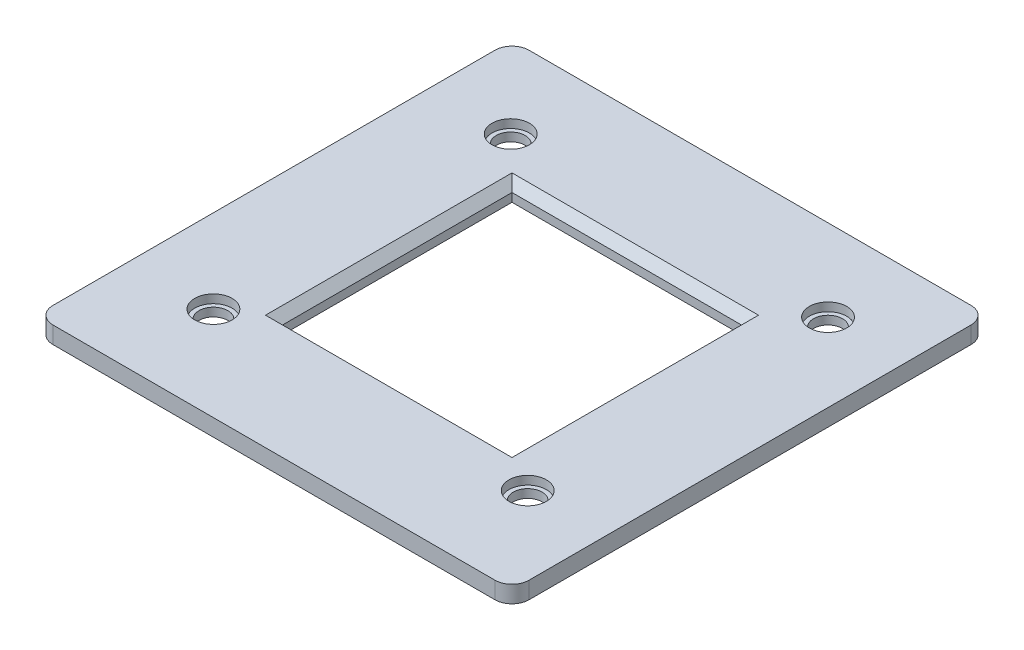
from build123d import *

# Parameters (mm, degrees)
SKETCH1_W                                            = 56
SKETCH1_H                                            = 56
SKETCH1_W_2                                          = 27
SKETCH1_H_2                                          = 27
BOSS_EXTRUDE1_DEPTH                                  = 2
CHAMFER1_SIZE                                        = 1
CBORE_FOR_M3_CROSS_RECESS_PAN_HEAD_SCREW_D           = 3.4
CBORE_FOR_M3_CROSS_RECESS_PAN_HEAD_SCREW_DEPTH       = 5
CBORE_FOR_M3_CROSS_RECESS_PAN_HEAD_SCREW_CBORE_D     = 4.4
CBORE_FOR_M3_CROSS_RECESS_PAN_HEAD_SCREW_CBORE_DEPTH = 1
CBORE_FOR_M3_CROSS_RECESS_PAN_HEAD_SCREW_TIP         = 1.021463052
FILLET1_R                                            = 2


with BuildPart() as part:
    # Sketch1 → Boss-Extrude1 (new body)
    with BuildSketch(Plane(origin=(0, 0, 0), x_dir=(1, 0, 0), z_dir=(0, 1, 0))):
        with Locations((28, 28)):
            Rectangle(SKETCH1_W, SKETCH1_H)
        with Locations((28, 28)):
            Rectangle(SKETCH1_W_2, SKETCH1_H_2, mode=Mode.SUBTRACT)
    extrude(amount=BOSS_EXTRUDE1_DEPTH)

    # Chamfer1
    chamfer1_edges = [part.edges().sort_by_distance(p)[0] for p in [
        (14.5, 2, -28),
        (28, 2, -14.5),
        (41.5, 2, -28),
        (28, 2, -41.5),
    ]]
    chamfer(chamfer1_edges, length=CHAMFER1_SIZE)

    # CBORE for M3 Cross Recess Pan Head Screw1
    with Locations(Plane(origin=(0, 2, 0), x_dir=(1, 0, 0), z_dir=(0, 1, 0))):
        with Locations((9.461899873, 46.384256973), (46.794505385, 46.384256973), (46.794505385, 11.05161247), (9.820867233, 11.05161247)):
            CounterBoreHole(CBORE_FOR_M3_CROSS_RECESS_PAN_HEAD_SCREW_D / 2, CBORE_FOR_M3_CROSS_RECESS_PAN_HEAD_SCREW_CBORE_D / 2, CBORE_FOR_M3_CROSS_RECESS_PAN_HEAD_SCREW_CBORE_DEPTH, depth=CBORE_FOR_M3_CROSS_RECESS_PAN_HEAD_SCREW_DEPTH)
            with Locations((0, 0, -(CBORE_FOR_M3_CROSS_RECESS_PAN_HEAD_SCREW_DEPTH + CBORE_FOR_M3_CROSS_RECESS_PAN_HEAD_SCREW_TIP / 2))):  # 118° drill point
                Cone(0, CBORE_FOR_M3_CROSS_RECESS_PAN_HEAD_SCREW_D / 2, CBORE_FOR_M3_CROSS_RECESS_PAN_HEAD_SCREW_TIP, mode=Mode.SUBTRACT)

    # Fillet1
    fillet1_edges = [part.edges().sort_by_distance(p)[0] for p in [
        (0, 1, -56),
        (56, 1, -56),
        (56, 1, 0),
        (0, 1, 0),
    ]]
    fillet(fillet1_edges, radius=FILLET1_R)


solid = part.part
